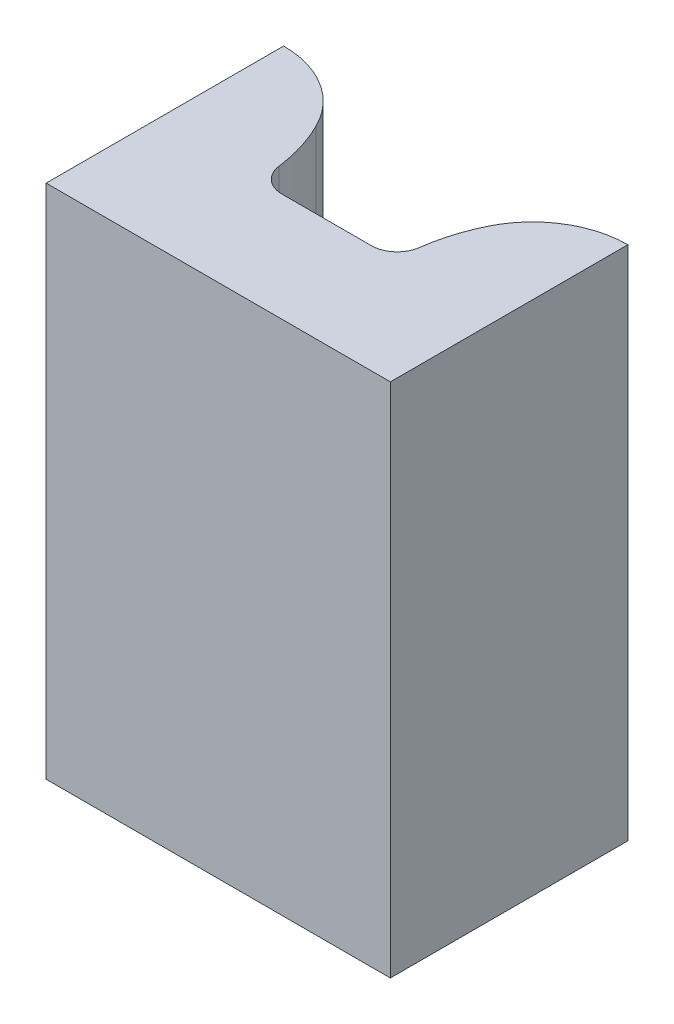
from build123d import *

# Parameters (mm, degrees)
BOSS_EXTRUDE1_DEPTH = 1.5


with BuildPart() as part:
    # Sketch1 → Boss-Extrude1 (new, symmetric)
    with BuildSketch(Plane(origin=(0, 0, 0), x_dir=(1, 0, 0), z_dir=(0, 1, 0))):
        with BuildLine():
            Line((0, 0), (2, 0))
            Line((2, 0), (2, 1.38))
            ThreePointArc((2, 1.38), (1.705850588, 1.295639059), (1.501123596, 1.068202247))
            ThreePointArc((1.501123596, 1.068202247), (1.442388286, 0.918062154), (1.408543109, 0.760434783))
            ThreePointArc((1.408543109, 0.760434783), (1.358731646, 0.667228588), (1.259824575, 0.63))
            Line((1.259824575, 0.63), (0.740175425, 0.63))
            ThreePointArc((0.740175425, 0.63), (0.641268354, 0.667228588), (0.591456891, 0.760434783))
            ThreePointArc((0.591456891, 0.760434783), (0.557611714, 0.918062154), (0.498876404, 1.068202247))
            ThreePointArc((0.498876404, 1.068202247), (0.294149412, 1.295639059), (0, 1.38))
            Line((0, 1.38), (0, 0))
        make_face()
    extrude(amount=BOSS_EXTRUDE1_DEPTH, both=True)


solid = part.part
